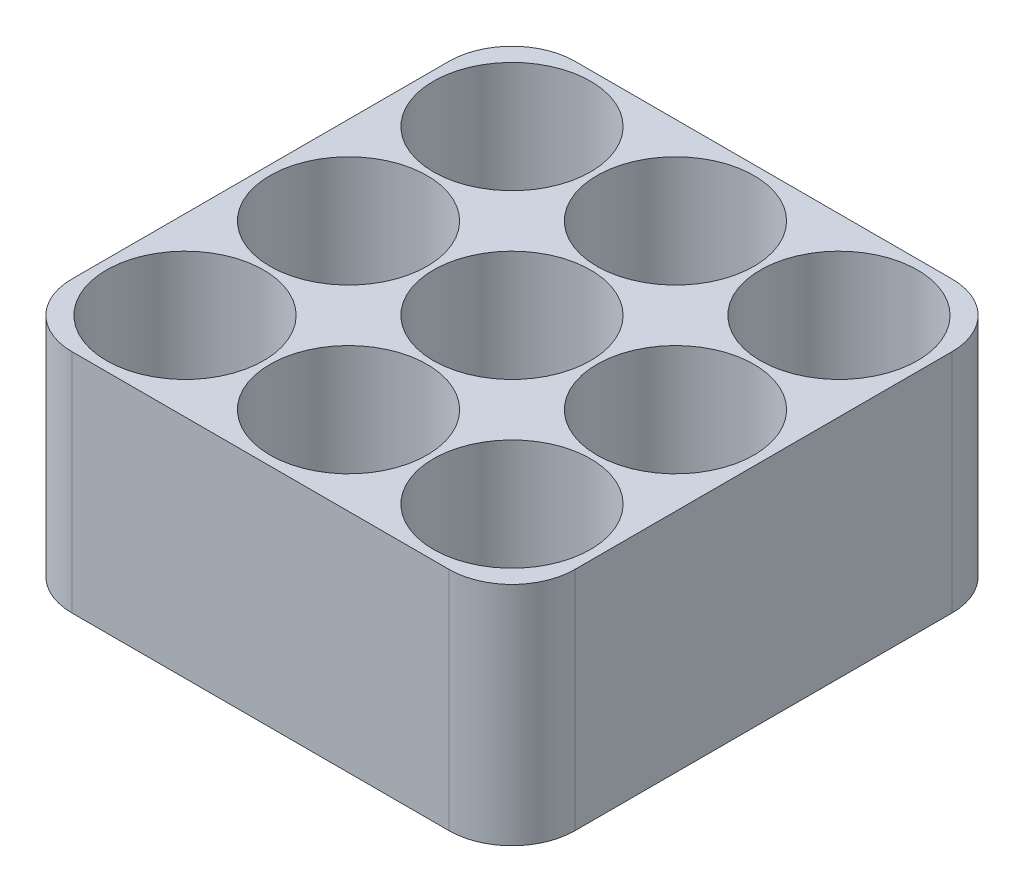
from build123d import *

# Parameters (mm, degrees)
SKETCH2_W           = 80
SKETCH2_H           = 80
SKETCH2_R           = 12.5
BOSS_EXTRUDE2_DEPTH = 35
SKETCH3_W           = 80
SKETCH3_H           = 80
BOSS_EXTRUDE3_DEPTH = 1
FILLET1_R           = 10


with BuildPart() as part:
    # Sketch2 → Boss-Extrude2 (new body)
    with BuildSketch(Plane(origin=(0, 0, 0), x_dir=(1, 0, 0), z_dir=(0, 1, 0))):
        with Locations((26, 26)):
            Rectangle(SKETCH2_W, SKETCH2_H)
        with Locations(Location((0, 0, 0), (0, 0, 270))):
            Circle(SKETCH2_R, mode=Mode.SUBTRACT)
        with Locations(Location((26, 0, 0), (0, 0, 270))):
            Circle(SKETCH2_R, mode=Mode.SUBTRACT)
        with Locations(Location((52, 0, 0), (0, 0, 270))):
            Circle(SKETCH2_R, mode=Mode.SUBTRACT)
        with Locations(Location((26, 26, 0), (0, 0, 270))):
            Circle(SKETCH2_R, mode=Mode.SUBTRACT)
        with Locations(Location((52, 26, 0), (0, 0, 270))):
            Circle(SKETCH2_R, mode=Mode.SUBTRACT)
        with Locations(Location((26, 52, 0), (0, 0, 270))):
            Circle(SKETCH2_R, mode=Mode.SUBTRACT)
        with Locations(Location((52, 52, 0), (0, 0, 270))):
            Circle(SKETCH2_R, mode=Mode.SUBTRACT)
        with Locations(Location((0, 26, 0), (0, 0, 270))):
            Circle(SKETCH2_R, mode=Mode.SUBTRACT)
        with Locations(Location((0, 52, 0), (0, 0, 270))):
            Circle(SKETCH2_R, mode=Mode.SUBTRACT)
    extrude(amount=BOSS_EXTRUDE2_DEPTH)

    # Sketch3 → Boss-Extrude3 (add)
    with BuildSketch(Plane.XZ):
        with Locations((26, -26)):
            Rectangle(SKETCH3_W, SKETCH3_H)
    extrude(amount=BOSS_EXTRUDE3_DEPTH)

    # Fillet1
    fillet1_edges = [part.edges().sort_by_distance(p)[0] for p in [
        (66, 17, 14),
        (-14, 17, 14),
        (-14, 17, -66),
        (66, 17, -66),
    ]]
    fillet(fillet1_edges, radius=FILLET1_R)


solid = part.part
